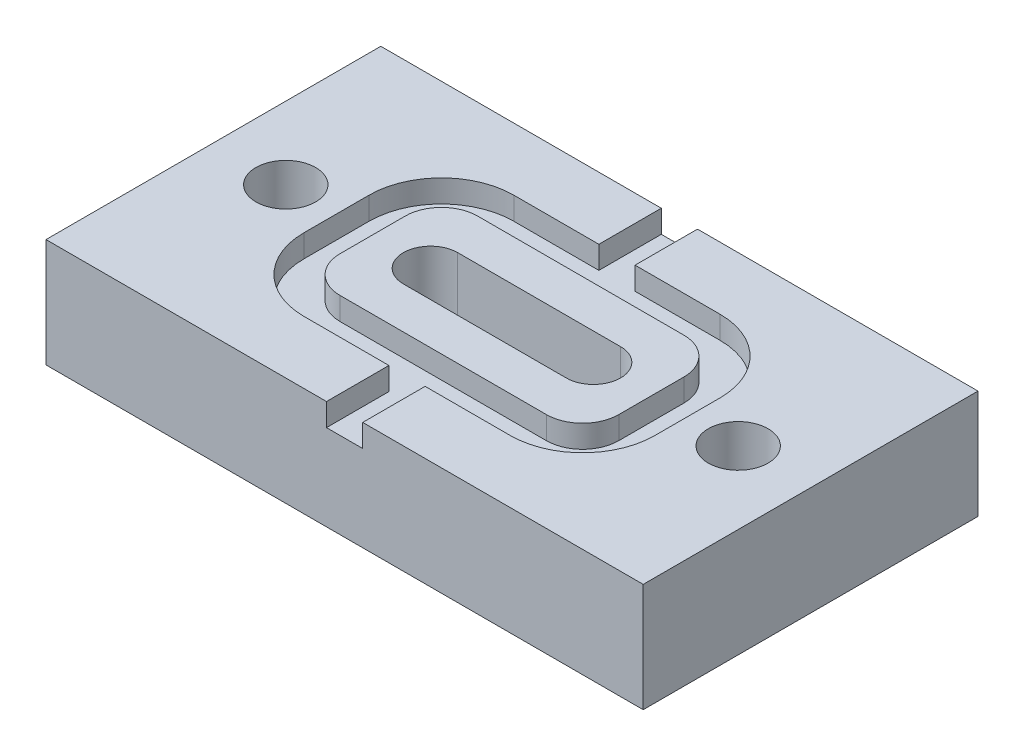
from build123d import *

# Parameters (mm, degrees)
SKETCH2_W           = 33
SKETCH2_H           = 18.5
BOSS_EXTRUDE1_DEPTH = 6
CUT_EXTRUDE1_DEPTH  = 1.25
SKETCH4_R           = 1.65
CUT_EXTRUDE2_DEPTH  = 20.844709622
CUT_EXTRUDE3_DEPTH  = 20.844709622


with BuildPart() as part:
    # Sketch2 → Boss-Extrude1 (new body)
    with BuildSketch(Plane(origin=(0, 0, 0), x_dir=(1, 0, 0), z_dir=(0, 1, 0))):
        Rectangle(SKETCH2_W, SKETCH2_H)
    extrude(amount=BOSS_EXTRUDE1_DEPTH)

    # Sketch3 → Cut-Extrude1 (cut)
    with BuildSketch(Plane(origin=(0, 6, 0), x_dir=(1, 0, 0), z_dir=(0, 1, 0))):
        with BuildLine():
            Line((-1, 9.25), (1, 9.25))
            Line((1, 9.25), (1, 5.8))
            Line((1, 5.8), (5.7, 5.8))
            ThreePointArc((5.7, 5.8), (8.528427125, 4.628427125), (9.7, 1.8))
            Line((9.7, 1.8), (9.7, -1.8))
            ThreePointArc((9.7, -1.8), (8.528427125, -4.628427125), (5.7, -5.8))
            Line((5.7, -5.8), (1, -5.8))
            Line((1, -5.8), (1, -9.25))
            Line((1, -9.25), (-1, -9.25))
            Line((-1, -9.25), (-1, -5.8))
            Line((-1, -5.8), (-5.7, -5.8))
            ThreePointArc((-5.7, -5.8), (-8.528427125, -4.628427125), (-9.7, -1.8))
            Line((-9.7, -1.8), (-9.7, 1.8))
            ThreePointArc((-9.7, 1.8), (-8.528427125, 4.628427125), (-5.7, 5.8))
            Line((-5.7, 5.8), (-1, 5.8))
            Line((-1, 5.8), (-1, 9.25))
        make_face()
        with BuildLine():
            Line((-5.7, -3.8), (5.7, -3.8))
            ThreePointArc((5.7, -3.8), (7.114213562, -3.214213562), (7.7, -1.8))
            Line((7.7, -1.8), (7.7, 1.8))
            ThreePointArc((7.7, 1.8), (7.114213562, 3.214213562), (5.7, 3.8))
            Line((5.7, 3.8), (-5.7, 3.8))
            ThreePointArc((-5.7, 3.8), (-7.114213562, 3.214213562), (-7.7, 1.8))
            Line((-7.7, 1.8), (-7.7, -1.8))
            ThreePointArc((-7.7, -1.8), (-7.114213562, -3.214213562), (-5.7, -3.8))
        make_face(mode=Mode.SUBTRACT)
    extrude(amount=-CUT_EXTRUDE1_DEPTH, mode=Mode.SUBTRACT)

    # Sketch4 → Cut-Extrude2 (cut, through all)
    with BuildSketch(Plane(origin=(0, 6, 0), x_dir=(1, 0, 0), z_dir=(0, 1, 0))):
        with Locations(Location((-12.5, 0, 0), (0, 0, 270))):
            Circle(SKETCH4_R)
        with Locations(Location((12.5, 0, 0), (0, 0, 270))):
            Circle(SKETCH4_R)
    extrude(amount=-CUT_EXTRUDE2_DEPTH, mode=Mode.SUBTRACT)

    # Sketch5 → Cut-Extrude3 (cut, through all)
    with BuildSketch(Plane(origin=(0, 6, 0), x_dir=(1, 0, 0), z_dir=(0, 1, 0))):
        with BuildLine():
            Line((-4.5, -1.5), (4.5, -1.5))
            ThreePointArc((4.5, -1.5), (6, 0), (4.5, 1.5))
            Line((4.5, 1.5), (-4.5, 1.5))
            ThreePointArc((-4.5, 1.5), (-6, 0), (-4.5, -1.5))
        make_face()
    extrude(amount=-CUT_EXTRUDE3_DEPTH, mode=Mode.SUBTRACT)


solid = part.part
